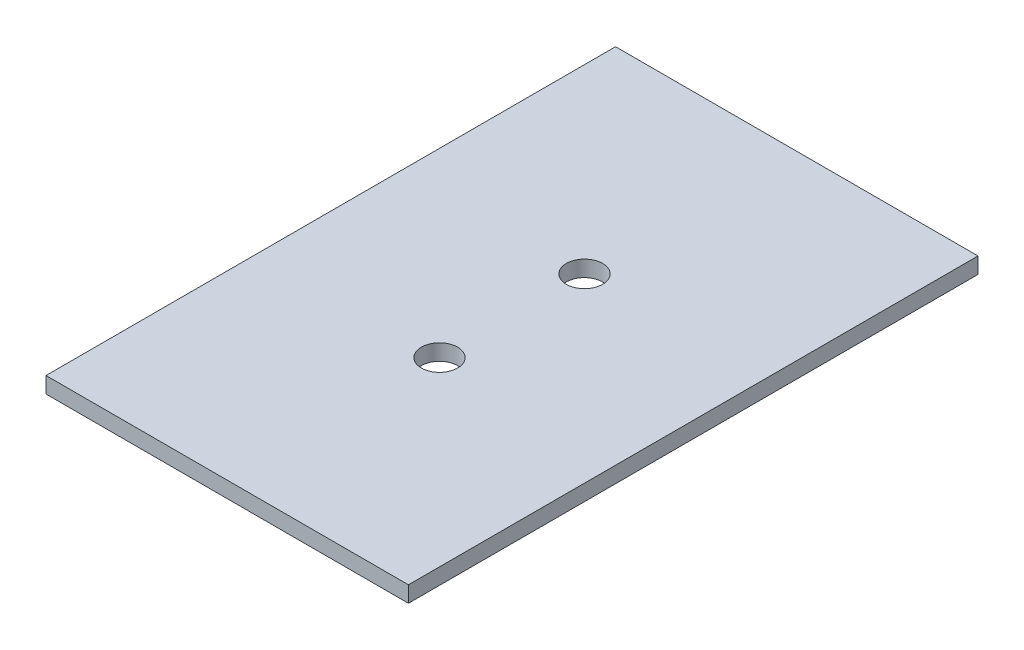
from build123d import *

# Parameters (mm, degrees)
SKETCH1_W           = 35
SKETCH1_H           = 55
BOSS_EXTRUDE1_DEPTH = 0.775
SKETCH2_R           = 1.75
CUT_EXTRUDE1_DEPTH  = 5


with BuildPart() as part:
    # Sketch1 → Boss-Extrude1 (new, symmetric)
    with BuildSketch(Plane(origin=(0, 0, 0), x_dir=(1, 0, 0), z_dir=(0, 1, 0))):
        Rectangle(SKETCH1_W, SKETCH1_H)
    extrude(amount=BOSS_EXTRUDE1_DEPTH, both=True)

    # Sketch2 → Cut-Extrude1 (cut, symmetric)
    with BuildSketch(Plane(origin=(0, 0, 0), x_dir=(1, 0, 0), z_dir=(0, 1, 0))):
        with Locations(Location((0, 7, 0), (0, 0, 270))):
            Circle(SKETCH2_R)
        with Locations(Location((0, -7, 0), (0, 0, 270))):
            Circle(SKETCH2_R)
    extrude(amount=CUT_EXTRUDE1_DEPTH, both=True, mode=Mode.SUBTRACT)


solid = part.part
